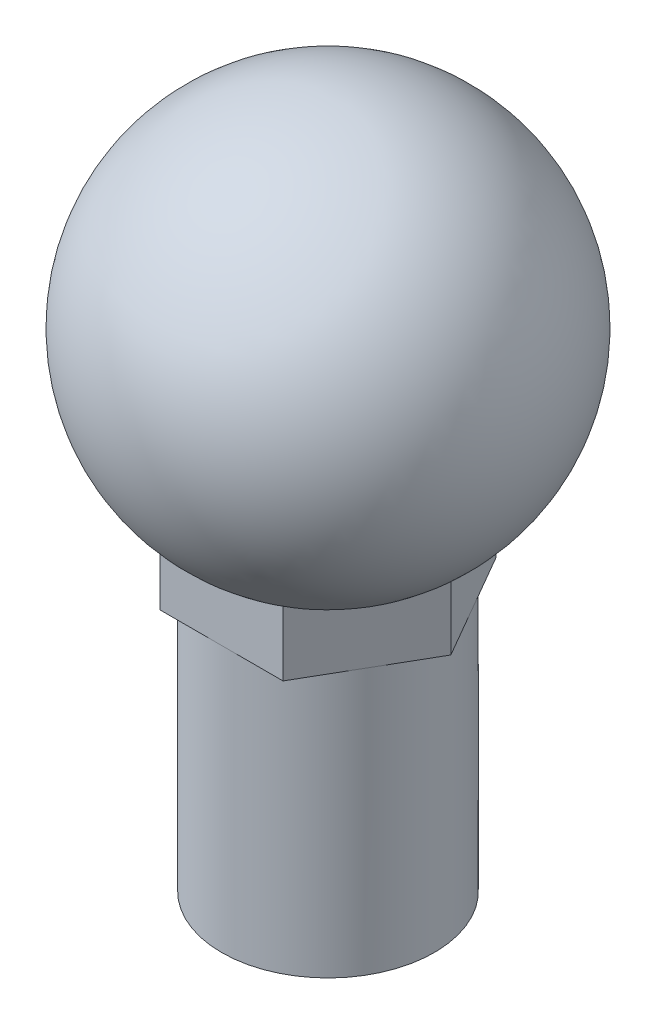
from build123d import *

# Parameters (mm, degrees)
SKETCH1_R           = 4
BOSS_EXTRUDE1_DEPTH = 12
BOSS_EXTRUDE3_DEPTH = 3


with BuildPart() as part:
    # Sketch1 → Boss-Extrude1 (new body)
    with BuildSketch(Plane(origin=(0, 0, 0), x_dir=(1, 0, 0), z_dir=(0, 1, 0))):
        with Locations(Location((0, 0, 0), (0, 0, 270))):
            Circle(SKETCH1_R)
    extrude(amount=BOSS_EXTRUDE1_DEPTH)

    # Sketch2 → Revolve1 (revolve)
    with BuildSketch(Plane.XY):
        with BuildLine():
            Line((0, 25.84428877), (0, 10.84428877))
            ThreePointArc((0, 10.84428877), (7.5, 18.34428877), (0, 25.84428877))
        make_face()
    revolve(axis=Axis((0, 25.84428877, 0), (0, -1, 0)))

    # Sketch4 → Boss-Extrude3 (add)
    with BuildSketch(Plane(origin=(0, 13, 0), x_dir=(-1, 0, 0), z_dir=(0, -1, 0))):
        Polygon((2.309401077, 4), (-2.309401077, 4), (-4.618802154, 0), (-2.309401077, -4), (2.309401077, -4), (4.618802154, 0), align=None)
    extrude(amount=BOSS_EXTRUDE3_DEPTH)


solid = part.part
